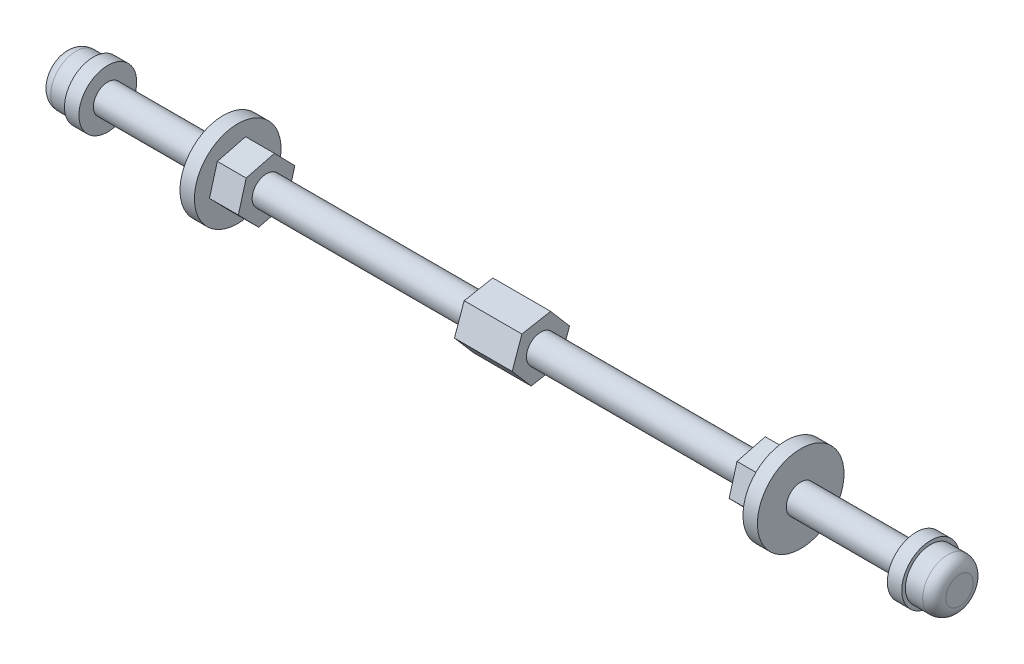
from build123d import *

# Parameters (mm, degrees)
BOSS_EXTRUDE1_DEPTH      = 6.35
BOSS_EXTRUDE1_DEPTH_BACK = 6.35
BOSS_EXTRUDE2_DEPTH      = 47.625
BOSS_EXTRUDE2_DEPTH_BACK = 66.675
SKETCH3_R                = 3.175
BOSS_EXTRUDE3_DEPTH      = 6.35
SKETCH5_R                = 9.525
BOSS_EXTRUDE4_DEPTH      = 3.175
SKETCH7_R                = 3.175
BOSS_EXTRUDE5_DEPTH      = 25.4
SKETCH8_R                = 6.35
BOSS_EXTRUDE6_DEPTH      = 3.175
SKETCH9_R                = 5.55625
BOSS_EXTRUDE7_DEPTH      = 6.35
FILLET1_R                = 2.54
FILLET1_OF_MIRROR2_R     = 2.54


with BuildPart() as part:
    # Sketch2 → Boss-Extrude1 (new, two sides: drawn at the far end of the back side and taken through both)
    with BuildSketch(Plane(origin=(0, 0, 0), x_dir=(0, 0, -1), z_dir=(1, 0, 0)).offset(-BOSS_EXTRUDE1_DEPTH_BACK)):
        Polygon((4.171210262, -4.874787896), (6.307295287, 1.174980103), (2.136085025, 6.049767999), (-4.171210262, 4.874787896), (-6.307295287, -1.174980103), (-2.136085025, -6.049767999), align=None)
    extrude(amount=BOSS_EXTRUDE1_DEPTH + BOSS_EXTRUDE1_DEPTH_BACK)

    # Sketch3 → Boss-Extrude2 (add, two sides: drawn at the far end of the back side and taken through both)
    with BuildSketch(Plane(origin=(6.35, 0, 0), x_dir=(0, 0, -1), z_dir=(1, 0, 0)).offset(-BOSS_EXTRUDE2_DEPTH_BACK)):
        Circle(SKETCH3_R)
    extrude(amount=BOSS_EXTRUDE2_DEPTH + BOSS_EXTRUDE2_DEPTH_BACK)

    # Sketch4 → Boss-Extrude3 (add)
    with BuildSketch(Plane(origin=(53.975, 0, 0), x_dir=(0, 0, -1), z_dir=(1, 0, 0))):
        Polygon((4.488142835, -4.584662035), (6.214505208, 1.594514693), (1.726362373, 6.179176728), (-4.488142835, 4.584662035), (-6.214505208, -1.594514693), (-1.726362373, -6.179176728), align=None)
    boss_extrude3 = extrude(amount=BOSS_EXTRUDE3_DEPTH)

    # Sketch5 → Boss-Extrude4 (add)
    with BuildSketch(Plane(origin=(60.325, 0, 0), x_dir=(0, 0, -1), z_dir=(1, 0, 0))):
        Circle(SKETCH5_R)
    boss_extrude4 = extrude(amount=BOSS_EXTRUDE4_DEPTH)

    # Mirror1: Boss-Extrude3, Boss-Extrude4 across plane
    add(boss_extrude3.mirror(Plane(origin=(0, 0, 0), x_dir=(0, 0, 1), z_dir=(1, 0, 0))))
    add(boss_extrude4.mirror(Plane(origin=(0, 0, 0), x_dir=(0, 0, 1), z_dir=(1, 0, 0))))

    # Sketch7 → Boss-Extrude5 (add)
    with BuildSketch(Plane(origin=(63.5, 0, 0), x_dir=(0, 0, -1), z_dir=(1, 0, 0))):
        Circle(SKETCH7_R)
    boss_extrude5 = extrude(amount=BOSS_EXTRUDE5_DEPTH)

    # Sketch8 → Boss-Extrude6 (add)
    with BuildSketch(Plane(origin=(88.9, 0, 0), x_dir=(0, 0, -1), z_dir=(1, 0, 0))):
        Circle(SKETCH8_R)
    boss_extrude6 = extrude(amount=BOSS_EXTRUDE6_DEPTH)

    # Sketch9 → Boss-Extrude7 (add)
    with BuildSketch(Plane(origin=(92.075, 0, 0), x_dir=(0, 0, -1), z_dir=(1, 0, 0))):
        Circle(SKETCH9_R)
    boss_extrude7 = extrude(amount=BOSS_EXTRUDE7_DEPTH)

    # Fillet1
    fillet1_edges = [part.edges().sort_by_distance(p)[0] for p in [
        (98.425, 0, 5.55625),
    ]]
    fillet(fillet1_edges, radius=FILLET1_R)

    # Mirror2: Boss-Extrude5, Boss-Extrude6, Boss-Extrude7 across plane
    add(boss_extrude5.mirror(Plane(origin=(0, 0, 0), x_dir=(0, 0, 1), z_dir=(1, 0, 0))))
    add(boss_extrude6.mirror(Plane(origin=(0, 0, 0), x_dir=(0, 0, 1), z_dir=(1, 0, 0))))
    add(boss_extrude7.mirror(Plane(origin=(0, 0, 0), x_dir=(0, 0, 1), z_dir=(1, 0, 0))))

    # Fillet1 of Mirror2
    fillet1_of_mirror2_edges = [part.edges().sort_by_distance(p)[0] for p in [
        (-98.425, 0, 5.55625),
    ]]
    fillet(fillet1_of_mirror2_edges, radius=FILLET1_OF_MIRROR2_R)


solid = part.part
